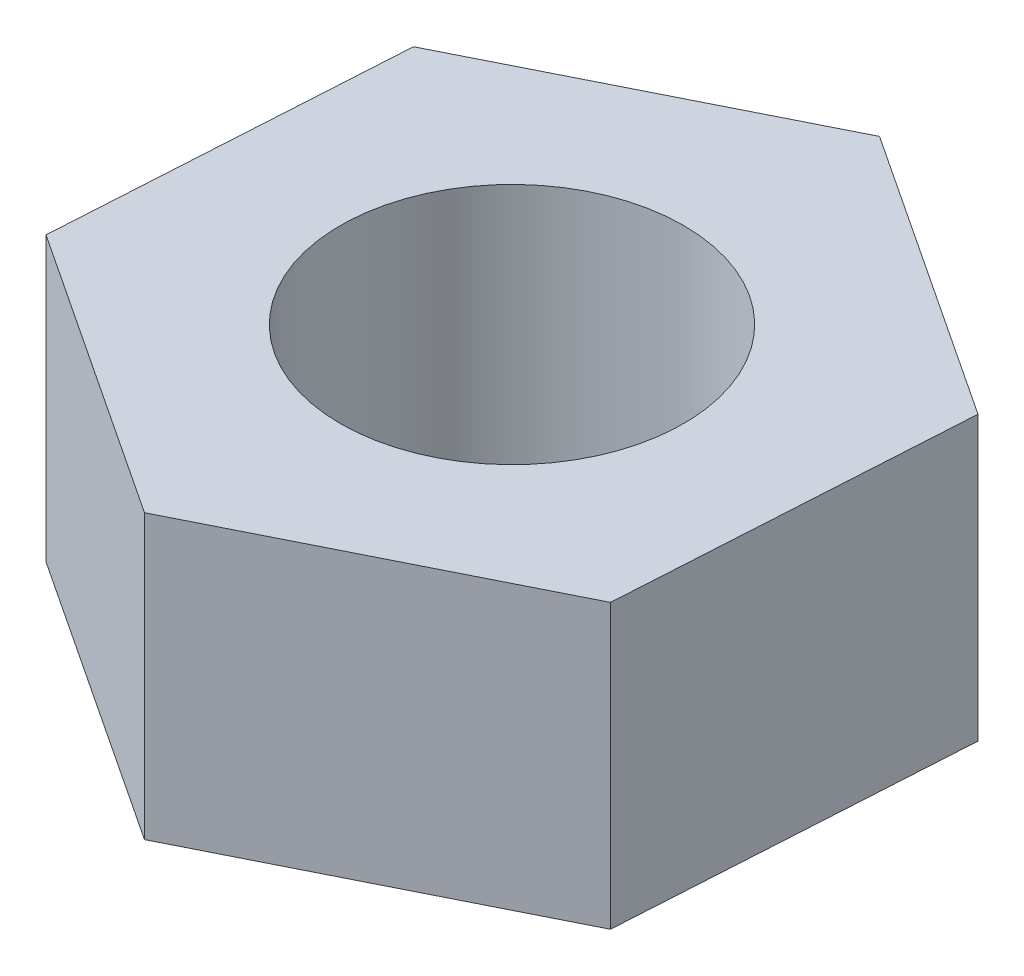
from build123d import *

# Parameters (mm, degrees)
SKETCH1_R           = 4.85
BOSS_EXTRUDE1_DEPTH = 8


with BuildPart() as part:
    # Sketch1 → Boss-Extrude1 (new body)
    with BuildSketch(Plane(origin=(0, 0, 0), x_dir=(1, 0, 0), z_dir=(0, 1, 0))):
        Polygon((-8.778762251, -4.389381126), (-0.588065564, -9.797321686), (8.190696687, -5.407940561), (8.778762251, 4.389381126), (0.588065564, 9.797321686), (-8.190696687, 5.407940561), align=None)
        with Locations(Location((0, 0, 0), (0, 0, 270))):
            Circle(SKETCH1_R, mode=Mode.SUBTRACT)
    extrude(amount=BOSS_EXTRUDE1_DEPTH)


solid = part.part
